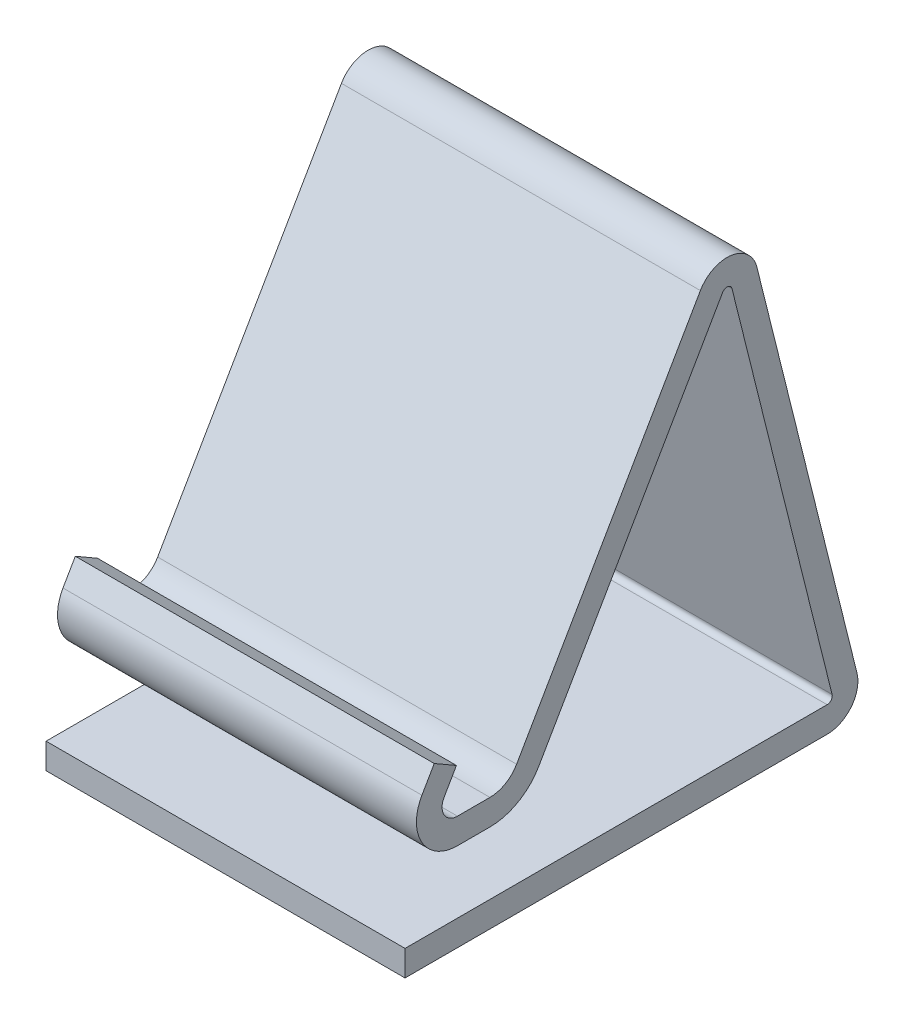
from build123d import *

# Parameters (mm, degrees)
EXTRUDE_1_DEPTH = 70


with BuildPart() as part:
    # 草图1 → 凸台-拉伸1 (new body)
    with BuildSketch(Plane(origin=(0, 0, 0), x_dir=(0, 0, -1), z_dir=(1, 0, 0))):
        with BuildLine():
            Line((-14.907268764, 7.463903752), (-17.309192553, 3.303649714))
            ThreePointArc((-17.309192553, 3.303649714), (-17.309192553, 0.303649714), (-14.711116341, -1.196350286))
            Line((-14.711116341, -1.196350286), (-8.371370379, -1.196350286))
            ThreePointArc((-8.371370379, -1.196350286), (-5.371370379, -0.392502709), (-3.175217956, 1.803649714))
            Line((-3.175217956, 1.803649714), (32.667470676, 63.885007505))
            ThreePointArc((32.667470676, 63.885007505), (38.698661704, 66.826615917), (43.685397456, 62.336538878))
            Line((43.685397456, 62.336538878), (63.208695005, -15.967130691))
            ThreePointArc((63.208695005, -15.967130691), (62.114985169, -21.112630917), (57.386920648, -23.418662065))
            Line((57.386920648, -23.418662065), (-24.933429559, -23.418662065))
            Line((-24.933429559, -23.418662065), (-24.933429559, -18.418662065))
            Line((-24.933429559, -18.418662065), (57.386920648, -18.418662065))
            ThreePointArc((57.386920648, -18.418662065), (58.174931401, -18.03432354), (58.357216374, -17.176740169))
            Line((58.357216374, -17.176740169), (38.833918825, 61.1269294))
            ThreePointArc((38.833918825, 61.1269294), (38.0027962, 61.875275573), (36.997597695, 61.385007505))
            Line((36.997597695, 61.385007505), (1.154909063, -0.696350286))
            ThreePointArc((1.154909063, -0.696350286), (-2.871370379, -4.722629728), (-8.371370379, -6.196350286))
            Line((-8.371370379, -6.196350286), (-14.711116341, -6.196350286))
            ThreePointArc((-14.711116341, -6.196350286), (-21.639319571, -2.196350286), (-21.639319571, 5.803649714))
            Line((-21.639319571, 5.803649714), (-19.237395783, 9.963903752))
            Line((-19.237395783, 9.963903752), (-14.907268764, 7.463903752))
        make_face()
    extrude(amount=EXTRUDE_1_DEPTH)


solid = part.part
